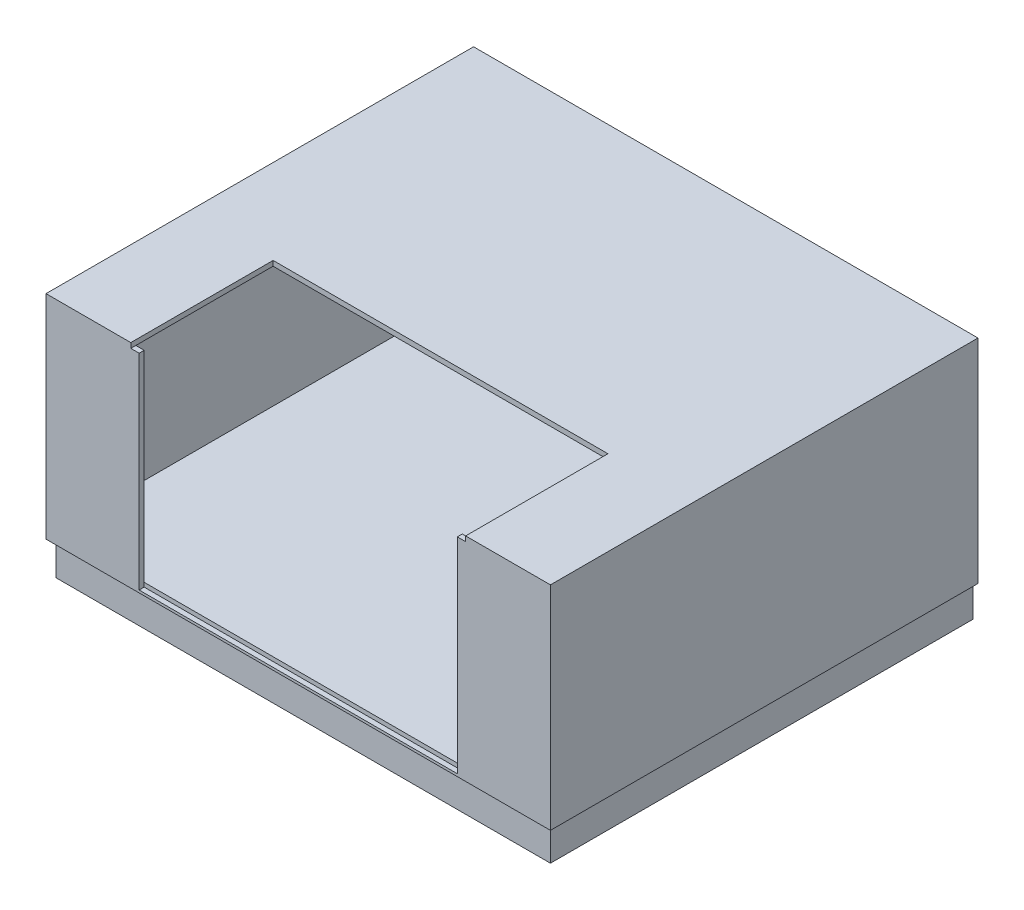
from build123d import *

# Parameters (mm, degrees)
SKETCH_1_W          = 602.574462866
SKETCH_1_H          = 504.761774505
EXTRUDE_1_DEPTH     = 8
SKETCH_2_W          = 6
SKETCH_2_H          = 504.761774505
EXTRUDE_2_DEPTH     = 240
SKETCH_3_W          = 602.574462866
SKETCH_3_H          = 504.761774505
EXTRUDE_3_DEPTH     = 6
SKETCH_5_W          = 602.574462866
SKETCH_5_H          = 254
EXTRUDE_4_DEPTH     = 6
SKETCH_4_W          = 400
SKETCH_4_H          = 170
CUT_EXTRUDE_4_DEPTH = 6
SKETCH_9_W          = 380
SKETCH_9_H          = 245
CUT_EXTRUDE_5_DEPTH = 6
EXTRUDE_8_DEPTH     = 40


with BuildPart() as part:
    # Эскиз1 → Бобышка-Вытянуть1 (new body)
    with BuildSketch(Plane(origin=(0, 0, 0), x_dir=(1, 0, 0), z_dir=(0, 1, 0))):
        with Locations((300, -321.529892077)):
            Rectangle(SKETCH_1_W, SKETCH_1_H)
    extrude(amount=EXTRUDE_1_DEPTH)

    # Эскиз2 → Бобышка-Вытянуть2 (add)
    with BuildSketch(Plane(origin=(0, 8, 0), x_dir=(1, 0, 0), z_dir=(0, 1, 0))):
        with Locations((1.712768567, -321.529892077)):
            Rectangle(SKETCH_2_W, SKETCH_2_H)
        with Locations((598.287231433, -321.529892077)):
            Rectangle(SKETCH_2_W, SKETCH_2_H)
    extrude(amount=EXTRUDE_2_DEPTH)

    # Эскиз3 → Бобышка-Вытянуть3 (add)
    with BuildSketch(Plane(origin=(0, 248, 0), x_dir=(1, 0, 0), z_dir=(0, 1, 0))):
        with Locations((300, -321.529892077)):
            Rectangle(SKETCH_3_W, SKETCH_3_H)
    extrude(amount=EXTRUDE_3_DEPTH)

    # Эскиз5 → Бобышка-Вытянуть4 (add)
    with BuildSketch(Plane.XY.offset(573.910779329)):
        with Locations((300, 127)):
            Rectangle(SKETCH_5_W, SKETCH_5_H)
    extrude(amount=EXTRUDE_4_DEPTH)

    # Эскиз4 → Вырез-Вытянуть4 (cut)
    with BuildSketch(Plane(origin=(0, 254, 0), x_dir=(1, 0, 0), z_dir=(0, 1, 0))):
        with Locations((300, -494.910779329)):
            Rectangle(SKETCH_4_W, SKETCH_4_H)
    extrude(amount=-CUT_EXTRUDE_4_DEPTH, mode=Mode.SUBTRACT)

    # Эскиз9 → Вырез-Вытянуть5 (cut)
    with BuildSketch(Plane.XY.offset(579.910779329)):
        with Locations((300, 125.5)):
            Rectangle(SKETCH_9_W, SKETCH_9_H)
    extrude(amount=-CUT_EXTRUDE_5_DEPTH, mode=Mode.SUBTRACT)

    # Эскиз12 → Бобышка-Вытянуть8 (add)
    with BuildSketch(Plane.XZ):
        Polygon((4.712768567, 573.910779329), (595.287231433, 573.910779329), (595.287231433, 69.149004824), (555.287231433, 69.149004824), (555.287231433, 533.910779329), (44.712768567, 533.910779329), (44.712768567, 69.149004824), (4.712768567, 69.149004824), align=None)
    extrude(amount=EXTRUDE_8_DEPTH)


solid = part.part
